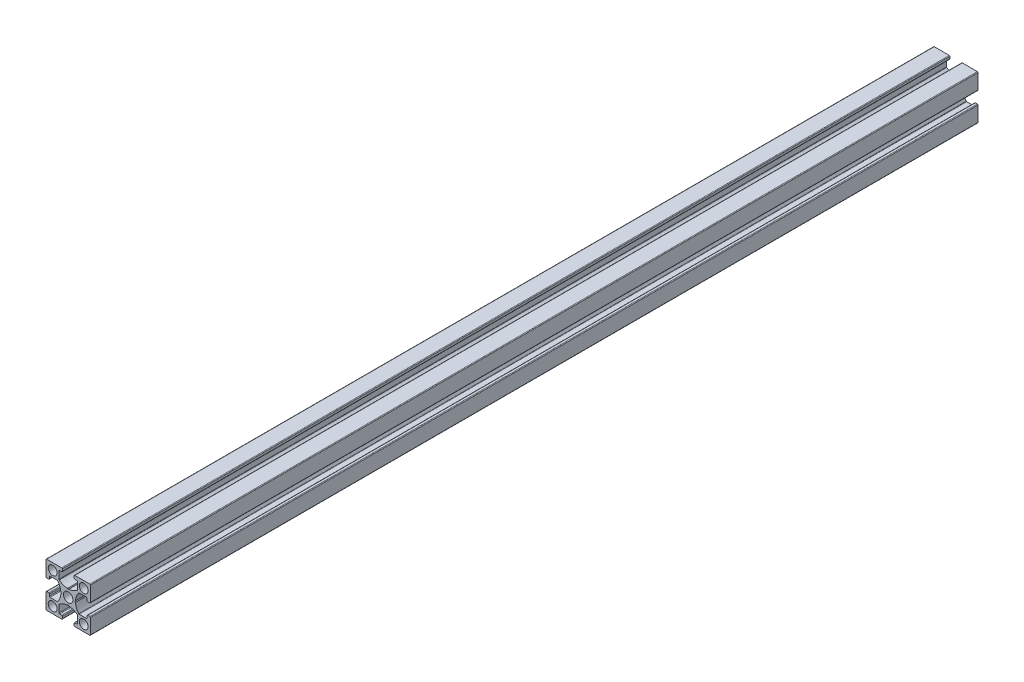
from build123d import *

# Parameters (mm, degrees)
MODEL_R         = 2.15
MODEL_R_2       = 2
EXTRUDE_1_DEPTH = 400


with BuildPart() as part:
    # Model → 보스-돌출1 (new body)
    with BuildSketch(Plane.XY):
        with BuildLine():
            Line((2307.763927197, 1192.134297913), (2307.763927197, 1195.391548465))
            ThreePointArc((2307.763927197, 1195.391548465), (2307.676059232, 1195.603680499), (2307.463927197, 1195.691548465))
            Line((2307.463927197, 1195.691548465), (2306.563927197, 1195.691548465))
            ThreePointArc((2306.563927197, 1195.691548465), (2306.351795163, 1195.779416431), (2306.263927197, 1195.991548465))
            Line((2306.263927197, 1195.991548465), (2306.263927197, 1196.891548465))
            ThreePointArc((2306.263927197, 1196.891548465), (2306.351795163, 1197.103680499), (2306.563927197, 1197.191548465))
            Line((2306.563927197, 1197.191548465), (2313.313927197, 1197.191548465))
            ThreePointArc((2313.313927197, 1197.191548465), (2313.526059232, 1197.103680499), (2313.613927197, 1196.891548465))
            Line((2313.613927197, 1196.891548465), (2313.613927197, 1190.141548465))
            ThreePointArc((2313.613927197, 1190.141548465), (2313.526059232, 1189.929416431), (2313.313927197, 1189.841548465))
            Line((2313.313927197, 1189.841548465), (2312.413927197, 1189.841548465))
            ThreePointArc((2312.413927197, 1189.841548465), (2312.201795163, 1189.929416431), (2312.113927197, 1190.141548465))
            Line((2312.113927197, 1190.141548465), (2312.113927197, 1191.041548465))
            ThreePointArc((2312.113927197, 1191.041548465), (2312.026059232, 1191.253680499), (2311.813927197, 1191.341548465))
            Line((2311.813927197, 1191.341548465), (2308.556676645, 1191.341548465))
            ThreePointArc((2308.556676645, 1191.341548465), (2308.426234796, 1191.311705686), (2308.321744595, 1191.228114625))
            ThreePointArc((2308.321744595, 1191.228114625), (2307.328306374, 1189.47356999), (2306.921204563, 1187.498825831))
            Line((2306.921204563, 1187.498825831), (2306.613927197, 1187.191548465))
            Line((2306.613927197, 1187.191548465), (2306.921204563, 1186.884271099))
            ThreePointArc((2306.921204563, 1186.884271099), (2307.328306374, 1184.90952694), (2308.321744595, 1183.154982305))
            ThreePointArc((2308.321744595, 1183.154982305), (2308.426234796, 1183.071391244), (2308.556676645, 1183.041548465))
            Line((2308.556676645, 1183.041548465), (2311.813927197, 1183.041548465))
            ThreePointArc((2311.813927197, 1183.041548465), (2312.026059232, 1183.129416431), (2312.113927197, 1183.341548465))
            Line((2312.113927197, 1183.341548465), (2312.113927197, 1184.241548465))
            ThreePointArc((2312.113927197, 1184.241548465), (2312.201795163, 1184.453680499), (2312.413927197, 1184.541548465))
            Line((2312.413927197, 1184.541548465), (2313.313927197, 1184.541548465))
            ThreePointArc((2313.313927197, 1184.541548465), (2313.526059232, 1184.453680499), (2313.613927197, 1184.241548465))
            Line((2313.613927197, 1184.241548465), (2313.613927197, 1177.491548465))
            ThreePointArc((2313.613927197, 1177.491548465), (2313.526059232, 1177.279416431), (2313.313927197, 1177.191548465))
            Line((2313.313927197, 1177.191548465), (2306.563927197, 1177.191548465))
            ThreePointArc((2306.563927197, 1177.191548465), (2306.351795163, 1177.279416431), (2306.263927197, 1177.491548465))
            Line((2306.263927197, 1177.491548465), (2306.263927197, 1178.391548465))
            ThreePointArc((2306.263927197, 1178.391548465), (2306.351795163, 1178.603680499), (2306.563927197, 1178.691548465))
            Line((2306.563927197, 1178.691548465), (2307.463927197, 1178.691548465))
            ThreePointArc((2307.463927197, 1178.691548465), (2307.676059232, 1178.779416431), (2307.763927197, 1178.991548465))
            Line((2307.763927197, 1178.991548465), (2307.763927197, 1182.248799017))
            ThreePointArc((2307.763927197, 1182.248799017), (2307.734084418, 1182.379240866), (2307.650493357, 1182.483731067))
            ThreePointArc((2307.650493357, 1182.483731067), (2305.895948722, 1183.477169289), (2303.921204563, 1183.884271099))
            Line((2303.921204563, 1183.884271099), (2303.613927197, 1184.191548465))
            Line((2303.613927197, 1184.191548465), (2303.306649831, 1183.884271099))
            ThreePointArc((2303.306649831, 1183.884271099), (2301.331905673, 1183.477169289), (2299.577361038, 1182.483731067))
            ThreePointArc((2299.577361038, 1182.483731067), (2299.493769977, 1182.379240866), (2299.463927197, 1182.248799017))
            Line((2299.463927197, 1182.248799017), (2299.463927197, 1178.991548465))
            ThreePointArc((2299.463927197, 1178.991548465), (2299.551795163, 1178.779416431), (2299.763927197, 1178.691548465))
            Line((2299.763927197, 1178.691548465), (2300.663927197, 1178.691548465))
            ThreePointArc((2300.663927197, 1178.691548465), (2300.876059232, 1178.603680499), (2300.963927197, 1178.391548465))
            Line((2300.963927197, 1178.391548465), (2300.963927197, 1177.491548465))
            ThreePointArc((2300.963927197, 1177.491548465), (2300.876059232, 1177.279416431), (2300.663927197, 1177.191548465))
            Line((2300.663927197, 1177.191548465), (2293.913927197, 1177.191548465))
            ThreePointArc((2293.913927197, 1177.191548465), (2293.701795163, 1177.279416431), (2293.613927197, 1177.491548465))
            Line((2293.613927197, 1177.491548465), (2293.613927197, 1184.241548465))
            ThreePointArc((2293.613927197, 1184.241548465), (2293.701795163, 1184.453680499), (2293.913927197, 1184.541548465))
            Line((2293.913927197, 1184.541548465), (2294.813927197, 1184.541548465))
            ThreePointArc((2294.813927197, 1184.541548465), (2295.026059232, 1184.453680499), (2295.113927197, 1184.241548465))
            Line((2295.113927197, 1184.241548465), (2295.113927197, 1183.341548465))
            ThreePointArc((2295.113927197, 1183.341548465), (2295.201795163, 1183.129416431), (2295.413927197, 1183.041548465))
            Line((2295.413927197, 1183.041548465), (2298.671177749, 1183.041548465))
            ThreePointArc((2298.671177749, 1183.041548465), (2298.801619599, 1183.071391244), (2298.906109799, 1183.154982305))
            ThreePointArc((2298.906109799, 1183.154982305), (2299.899548021, 1184.90952694), (2300.306649831, 1186.884271099))
            Line((2300.306649831, 1186.884271099), (2300.613927197, 1187.191548465))
            Line((2300.613927197, 1187.191548465), (2300.306649831, 1187.498825831))
            ThreePointArc((2300.306649831, 1187.498825831), (2299.899548021, 1189.47356999), (2298.906109799, 1191.228114625))
            ThreePointArc((2298.906109799, 1191.228114625), (2298.801619599, 1191.311705686), (2298.671177749, 1191.341548465))
            Line((2298.671177749, 1191.341548465), (2295.413927197, 1191.341548465))
            ThreePointArc((2295.413927197, 1191.341548465), (2295.201795163, 1191.253680499), (2295.113927197, 1191.041548465))
            Line((2295.113927197, 1191.041548465), (2295.113927197, 1190.141548465))
            ThreePointArc((2295.113927197, 1190.141548465), (2295.026059232, 1189.929416431), (2294.813927197, 1189.841548465))
            Line((2294.813927197, 1189.841548465), (2293.913927197, 1189.841548465))
            ThreePointArc((2293.913927197, 1189.841548465), (2293.701795163, 1189.929416431), (2293.613927197, 1190.141548465))
            Line((2293.613927197, 1190.141548465), (2293.613927197, 1196.891548465))
            ThreePointArc((2293.613927197, 1196.891548465), (2293.701795163, 1197.103680499), (2293.913927197, 1197.191548465))
            Line((2293.913927197, 1197.191548465), (2300.663927197, 1197.191548465))
            ThreePointArc((2300.663927197, 1197.191548465), (2300.876059232, 1197.103680499), (2300.963927197, 1196.891548465))
            Line((2300.963927197, 1196.891548465), (2300.963927197, 1195.991548465))
            ThreePointArc((2300.963927197, 1195.991548465), (2300.876059232, 1195.779416431), (2300.663927197, 1195.691548465))
            Line((2300.663927197, 1195.691548465), (2299.763927197, 1195.691548465))
            ThreePointArc((2299.763927197, 1195.691548465), (2299.551795163, 1195.603680499), (2299.463927197, 1195.391548465))
            Line((2299.463927197, 1195.391548465), (2299.463927197, 1192.134297913))
            ThreePointArc((2299.463927197, 1192.134297913), (2299.493769977, 1192.003856063), (2299.577361038, 1191.899365863))
            ThreePointArc((2299.577361038, 1191.899365863), (2301.331905673, 1190.905927641), (2303.306649831, 1190.498825831))
            Line((2303.306649831, 1190.498825831), (2303.613927197, 1190.191548465))
            Line((2303.613927197, 1190.191548465), (2303.921204563, 1190.498825831))
            ThreePointArc((2303.921204563, 1190.498825831), (2305.895948722, 1190.905927641), (2307.650493357, 1191.899365863))
            ThreePointArc((2307.650493357, 1191.899365863), (2307.734084418, 1192.003856063), (2307.763927197, 1192.134297913))
        make_face()
        with Locations((2303.613927197, 1187.191548465)):
            Circle(MODEL_R, mode=Mode.SUBTRACT)
        with Locations((2296.613927197, 1194.191548465)):
            Circle(MODEL_R_2, mode=Mode.SUBTRACT)
        with Locations((2296.613927197, 1180.191548465)):
            Circle(MODEL_R_2, mode=Mode.SUBTRACT)
        with Locations((2310.613927197, 1194.191548465)):
            Circle(MODEL_R_2, mode=Mode.SUBTRACT)
        with Locations((2310.613927197, 1180.191548465)):
            Circle(MODEL_R_2, mode=Mode.SUBTRACT)
    extrude(amount=EXTRUDE_1_DEPTH)


solid = part.part
